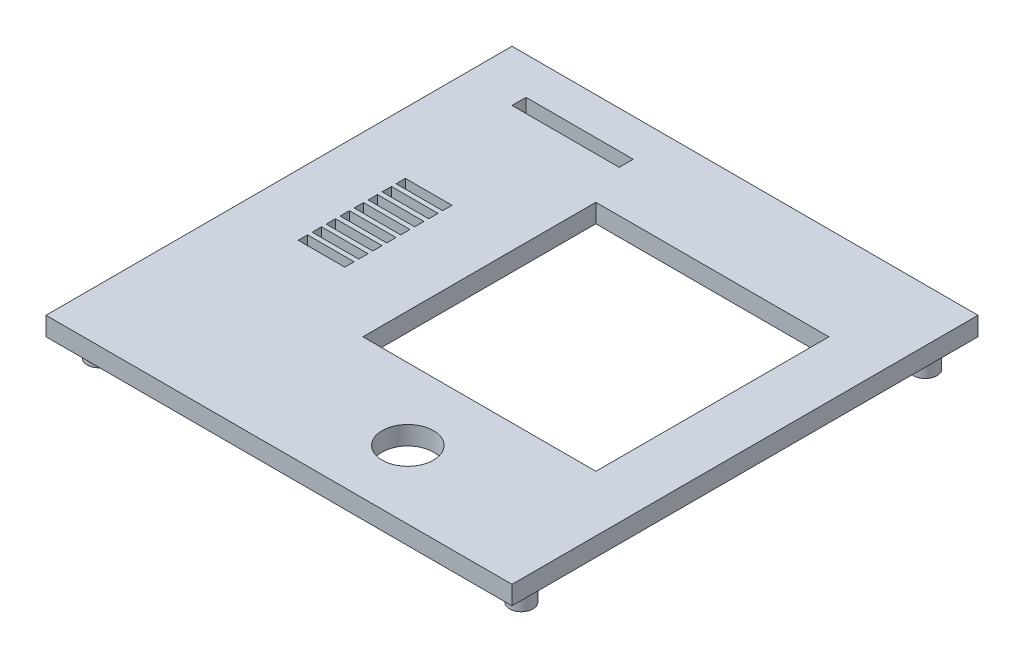
from build123d import *

# Parameters (mm, degrees)
SKETCH2_W           = 100
SKETCH2_H           = 100
BOSS_EXTRUDE1_DEPTH = 4
SKETCH3_W           = 50
SKETCH3_H           = 50
CUT_EXTRUDE1_DEPTH  = 4
SKETCH4_W           = 23
SKETCH4_H           = 3
CUT_EXTRUDE2_DEPTH  = 4
SKETCH5_W           = 10
SKETCH5_H           = 2
CUT_EXTRUDE3_DEPTH  = 4
LPATTERN1_COUNT     = 8
LPATTERN1_PITCH     = 3
SKETCH6_R           = 5.5
CUT_EXTRUDE4_DEPTH  = 4
SKETCH8_R           = 2.5
BOSS_EXTRUDE3_DEPTH = 5
SKETCH10_R          = 1.5
CUT_EXTRUDE5_DEPTH  = 3
SKETCH11_R          = 1.5
CUT_EXTRUDE7_DEPTH  = 7
SKETCH12_R          = 1.5
CUT_EXTRUDE8_DEPTH  = 4
SKETCH13_R          = 1.5
CUT_EXTRUDE9_DEPTH  = 4
SKETCH14_R          = 1.5
CUT_EXTRUDE10_DEPTH = 4


with BuildPart() as part:
    # Sketch2 → Boss-Extrude1 (new body)
    with BuildSketch(Plane(origin=(0, 0, 0), x_dir=(1, 0, 0), z_dir=(0, 1, 0))):
        Rectangle(SKETCH2_W, SKETCH2_H)
    extrude(amount=BOSS_EXTRUDE1_DEPTH)

    # Sketch3 → Cut-Extrude1 (cut)
    with BuildSketch(Plane(origin=(0, 4, 0), x_dir=(1, 0, 0), z_dir=(0, 1, 0))):
        with Locations((13, 5)):
            Rectangle(SKETCH3_W, SKETCH3_H)
    extrude(amount=-CUT_EXTRUDE1_DEPTH, mode=Mode.SUBTRACT)

    # Sketch4 → Cut-Extrude2 (cut)
    with BuildSketch(Plane(origin=(0, 4, 0), x_dir=(1, 0, 0), z_dir=(0, 1, 0))):
        with Locations((-27.5, 40.5)):
            Rectangle(SKETCH4_W, SKETCH4_H)
    extrude(amount=-CUT_EXTRUDE2_DEPTH, mode=Mode.SUBTRACT)

    # Sketch5 → Cut-Extrude3 (cut)
    with BuildSketch(Plane(origin=(0, 4, 0), x_dir=(1, 0, 0), z_dir=(0, 1, 0))):
        with Locations((-31.87977559, 13)):
            Rectangle(SKETCH5_W, SKETCH5_H)
    cut_extrude3 = extrude(amount=-CUT_EXTRUDE3_DEPTH, mode=Mode.SUBTRACT)

    # LPattern1: Cut-Extrude3 ×8
    with Locations(*[(0, 0, i * LPATTERN1_PITCH) for i in range(1, LPATTERN1_COUNT)]):
        add(cut_extrude3, mode=Mode.SUBTRACT)

    # Sketch6 → Cut-Extrude4 (cut)
    with BuildSketch(Plane(origin=(0, 4, 0), x_dir=(1, 0, 0), z_dir=(0, 1, 0))):
        with Locations(Location((13, -35.361632217, 0), (0, 0, 270))):
            Circle(SKETCH6_R)
    extrude(amount=-CUT_EXTRUDE4_DEPTH, mode=Mode.SUBTRACT)

    # Sketch8 → Boss-Extrude3 (add)
    with BuildSketch(Plane(origin=(0, 0, 0), x_dir=(-1, 0, 0), z_dir=(0, -1, 0))):
        with Locations(Location((45.34, 43.34, 0), (0, 0, 270))):
            Circle(SKETCH8_R)
        with Locations(Location((-45.34, 43.34, 0), (0, 0, 270))):
            Circle(SKETCH8_R)
        with Locations(Location((-45.34, -43.34, 0), (0, 0, 270))):
            Circle(SKETCH8_R)
        with Locations(Location((45.339, -43.339, 0), (0, 0, 270))):
            Circle(SKETCH8_R)
    extrude(amount=BOSS_EXTRUDE3_DEPTH)

    # Sketch10 → Cut-Extrude5 (cut)
    with BuildSketch(Plane.XZ):
        with Locations(Location((-45.34, -43.34, 0), (0, 0, 270))):
            Circle(SKETCH10_R)
        with Locations(Location((45.318764469, -43.34, 0), (0, 0, 270))):
            Circle(SKETCH10_R)
    extrude(amount=-CUT_EXTRUDE5_DEPTH, mode=Mode.SUBTRACT)

    # Sketch11 → Cut-Extrude7 (cut)
    with BuildSketch(Plane.XZ):
        with Locations(Location((45.34, 43.34, 0), (0, 0, 270))):
            Circle(SKETCH11_R)
    extrude(amount=CUT_EXTRUDE7_DEPTH, mode=Mode.SUBTRACT)

    # Sketch12 → Cut-Extrude8 (cut)
    with BuildSketch(Plane.XZ.offset(5)):
        with Locations(Location((45.34, -43.34, 0), (0, 0, 270))):
            Circle(SKETCH12_R)
    extrude(amount=-CUT_EXTRUDE8_DEPTH, mode=Mode.SUBTRACT)

    # Sketch13 → Cut-Extrude9 (cut)
    with BuildSketch(Plane.XZ.offset(5)):
        with Locations(Location((-45.34, -43.34, 0), (0, 0, 270))):
            Circle(SKETCH13_R)
    extrude(amount=-CUT_EXTRUDE9_DEPTH, mode=Mode.SUBTRACT)

    # Sketch14 → Cut-Extrude10 (cut)
    with BuildSketch(Plane.XZ.offset(5)):
        with Locations(Location((-45.339, 43.339, 0), (0, 0, 270))):
            Circle(SKETCH14_R)
    extrude(amount=-CUT_EXTRUDE10_DEPTH, mode=Mode.SUBTRACT)


solid = part.part
